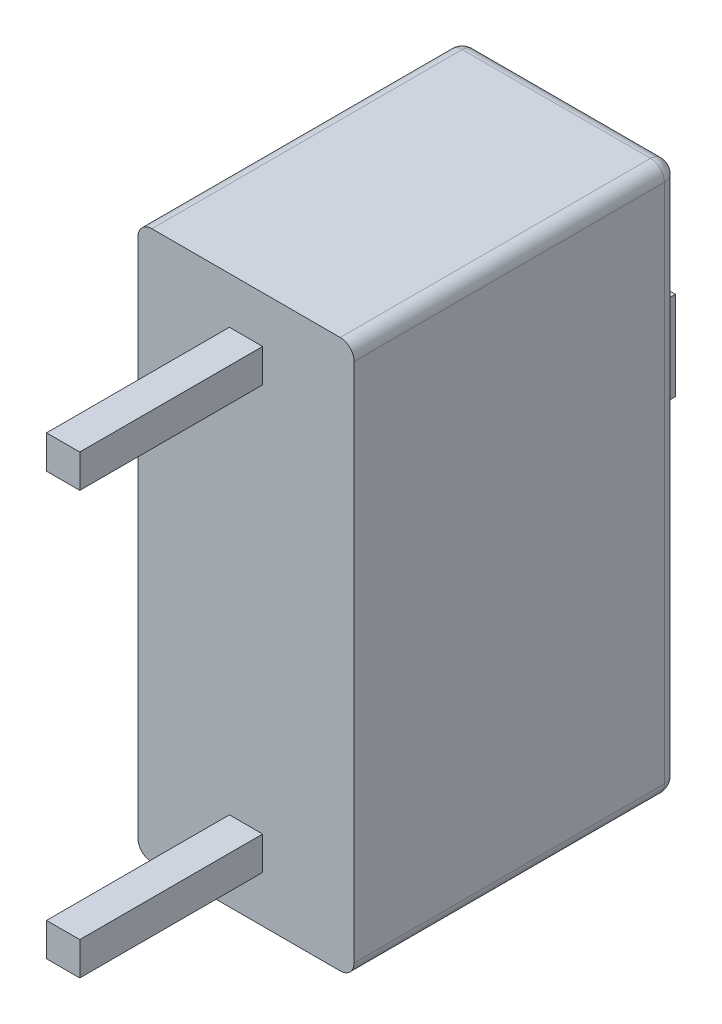
from build123d import *

# Parameters (mm, degrees)
IZIM1_W                     = 3.9
IZIM1_H                     = 9.9
Y_KSEKLIK_EKSTR_ZYON1_DEPTH = 5.85
IZIM3_W                     = 1.4
IZIM3_H                     = 3.2
KES_EKSTR_ZYON1_DEPTH       = 1
IZIM4_W                     = 1.4
IZIM4_H                     = 1.6
Y_KSEKLIK_EKSTR_ZYON2_DEPTH = 2.2
IZIM5_W                     = 1.4
IZIM5_H                     = 1.6
Y_KSEKLIK_EKSTR_ZYON3_DEPTH = 0.9
RADYUS1_R                   = 0.25
IZIM6_W                     = 0.6
IZIM6_H                     = 0.6
Y_KSEKLIK_EKSTR_ZYON4_DEPTH = 3.3


with BuildPart() as part:
    # Çizim1 → Yükseklik-Ekstrüzyon1 (new body)
    with BuildSketch(Plane.XY):
        Rectangle(IZIM1_W, IZIM1_H)
    extrude(amount=Y_KSEKLIK_EKSTR_ZYON1_DEPTH)

    # Çizim3 → Kes-Ekstrüzyon1 (cut)
    with BuildSketch(Plane(origin=(0, 0, 0), x_dir=(-1, 0, 0), z_dir=(0, 0, -1))):
        Rectangle(IZIM3_W, IZIM3_H)
    extrude(amount=-KES_EKSTR_ZYON1_DEPTH, mode=Mode.SUBTRACT)

    # Radyus1
    radyus1_edges = [part.edges().sort_by_distance(p)[0] for p in [
        (0, -4.95, 0),
        (-1.95, 0, 0),
        (0, 4.95, 0),
        (1.95, 0, 0),
        (1.95, -4.95, 2.925),
        (-1.95, -4.95, 2.925),
        (-1.95, 4.95, 2.925),
        (1.95, 4.95, 2.925),
    ]]
    fillet(radyus1_edges, radius=RADYUS1_R)

    # Çizim6 → Yükseklik-Ekstrüzyon4 (add)
    with BuildSketch(Plane.XY.offset(5.85)):
        with Locations((0, 3.81)):
            Rectangle(IZIM6_W, IZIM6_H)
        with Locations((0, -3.81)):
            Rectangle(IZIM6_W, IZIM6_H)
    extrude(amount=Y_KSEKLIK_EKSTR_ZYON4_DEPTH)


with BuildPart() as body_2:
    # Çizim4 → Yükseklik-Ekstrüzyon2 (new body)
    with BuildSketch(Plane(origin=(0, 0, 1), x_dir=(-1, 0, 0), z_dir=(0, 0, -1))):
        with Locations((0, 0.8)):
            Rectangle(IZIM4_W, IZIM4_H)
    extrude(amount=Y_KSEKLIK_EKSTR_ZYON2_DEPTH)


with BuildPart() as body_3:
    # Çizim5 → Yükseklik-Ekstrüzyon3 (new body)
    with BuildSketch(Plane(origin=(0, 0, 1), x_dir=(-1, 0, 0), z_dir=(0, 0, -1))):
        with Locations((0, -0.8)):
            Rectangle(IZIM5_W, IZIM5_H)
    extrude(amount=Y_KSEKLIK_EKSTR_ZYON3_DEPTH)


solid = Compound([part.part, body_2.part, body_3.part])
